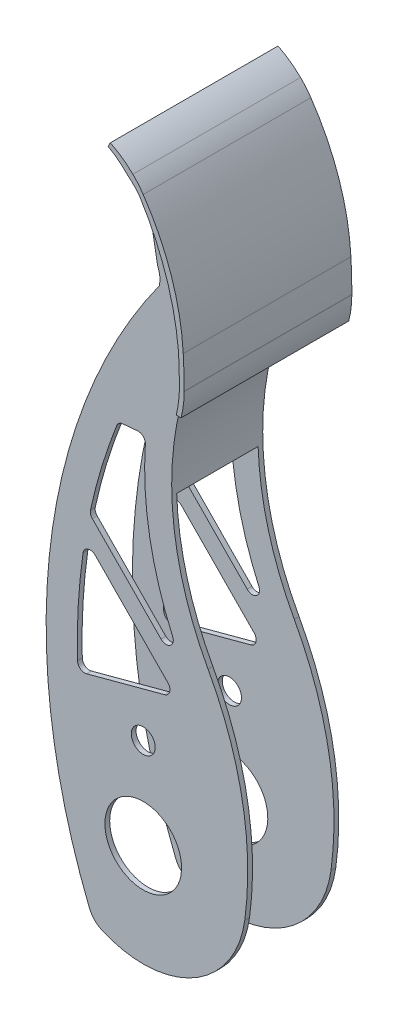
from build123d import *

# Parameters (mm, degrees)
SKETCH1_R           = 16
SKETCH1_R_2         = 5
BOSS_EXTRUDE3_DEPTH = 70
CUT_EXTRUDE2_DEPTH  = 16
CUT_EXTRUDE3_DEPTH  = 16
SKETCH7_W           = 34
SKETCH7_H           = 251.612307305
CUT_EXTRUDE4_DEPTH  = 87.5
CUT_EXTRUDE5_DEPTH  = 34
BOSS_EXTRUDE4_START = -38
BOSS_EXTRUDE4_DEPTH = 38
CUT_EXTRUDE6_DEPTH  = 135


with BuildPart() as part:
    # Sketch1 → Boss-Extrude3 (new body)
    with BuildSketch(Plane.XY):
        with BuildLine():
            Line((-18.492879119, 133.036316601), (-18.498498023, 133.025878551))
            ThreePointArc((-18.498498023, 133.025878551), (-22.931133945, 136.748933151), (-27.911859958, 139.698808598))
            Line((-27.911859958, 139.698808598), (-28.859852333, 137.937754807))
            ThreePointArc((-28.859852333, 137.937754807), (-24.623995913, 135.183968868), (-20.885371833, 131.785659496))
            ThreePointArc((-20.885371833, 131.785659496), (-18.192980361, 129.380347747), (-15.794912153, 126.681502565))
            Line((-15.794912153, 126.681502565), (-27.917185271, 110.194914382))
            Line((-27.917185271, 110.194914382), (-24.189891295, 89.250297825))
            ThreePointArc((-24.189891295, 89.250297825), (-23.276240724, 85.794240187), (-23.472804176, 82.224862851))
            ThreePointArc((-23.472804176, 82.224862851), (-68.872718383, -33.767386176), (-52.667247609, -157.269356853))
            ThreePointArc((-52.667247609, -157.269356853), (-50.575514204, -160.492975125), (-47.422535875, -162.689743445))
            ThreePointArc((-47.422535875, -162.689743445), (-9.297986917, -160.884668476), (12.205361962, -129.351423863))
            ThreePointArc((12.205361962, -129.351423863), (11.215393371, -86.524352781), (-3.124290711, -46.157144361))
            ThreePointArc((-3.124290711, -46.157144361), (-18.241573573, 16.806753647), (0.520816468, 78.782211802))
            ThreePointArc((0.520816468, 78.782211802), (0.815698001, 71.975939249), (0.917818465, 65.164047251))
            Line((0.917818465, 65.164047251), (0.943780266, 65.164047251))
            ThreePointArc((0.943780266, 65.164047251), (0.943812795, 65.09180253), (0.943823638, 65.019557802))
            ThreePointArc((0.943823638, 65.019557802), (0.529498651, 60.000787978), (-0.371750777, 55.04624812))
            Line((-0.371750777, 55.04624812), (1.628249223, 55.04624812))
            ThreePointArc((1.628249223, 55.04624812), (2.583543249, 60.061971917), (2.90683401, 65.157612698))
            ThreePointArc((2.90683401, 65.157612698), (2.906823344, 65.229857425), (2.906791346, 65.302102146))
            ThreePointArc((2.906791346, 65.302102146), (2.809025603, 72.019742255), (2.526858646, 78.732165705))
            ThreePointArc((2.526858646, 78.732165705), (-2.46660039, 104.447349639), (-14.187653785, 127.874304738))
            ThreePointArc((-14.187653785, 127.874304738), (-16.217340169, 130.557833748), (-18.492879119, 133.036316601))
        make_face()
        with Locations((-30.170544826, -123.552650361)):
            Circle(SKETCH1_R, mode=Mode.SUBTRACT)
        with Locations((-30.170544826, -85.552650361)):
            Circle(SKETCH1_R_2, mode=Mode.SUBTRACT)
    extrude(amount=BOSS_EXTRUDE3_DEPTH)

    # Sketch4 → Cut-Extrude2 (cut)
    with BuildSketch(Plane(origin=(0, 0, 0), x_dir=(-1, 0, 0), z_dir=(0, 0, -1))):
        with BuildLine():
            Line((27.917185271, 110.194914382), (15.794912153, 126.681502565))
            ThreePointArc((15.794912153, 126.681502565), (4.373722035, 103.843429765), (-0.520816468, 78.782211802))
            ThreePointArc((-0.520816468, 78.782211802), (18.241573573, 16.806753647), (3.124290711, -46.157144361))
            ThreePointArc((3.124290711, -46.157144361), (-11.215393371, -86.524352781), (-12.205361962, -129.351423863))
            ThreePointArc((-12.205361962, -129.351423863), (9.297986917, -160.884668476), (47.422535875, -162.689743445))
            ThreePointArc((47.422535875, -162.689743445), (50.575514204, -160.492975125), (52.667247609, -157.269356853))
            ThreePointArc((52.667247609, -157.269356853), (68.872718383, -33.767386176), (23.472804176, 82.224862851))
            ThreePointArc((23.472804176, 82.224862851), (23.276240724, 85.794240187), (24.189891295, 89.250297825))
            Line((24.189891295, 89.250297825), (27.917185271, 110.194914382))
        make_face()
    extrude(amount=-CUT_EXTRUDE2_DEPTH, mode=Mode.SUBTRACT)

    # Sketch5 → Cut-Extrude3 (cut)
    with BuildSketch(Plane.XY.offset(70)):
        with BuildLine():
            Line((-15.794912153, 126.681502565), (-106.344691982, 77.715450511))
            Line((-106.344691982, 77.715450511), (-99.056785555, -184.356883009))
            Line((-99.056785555, -184.356883009), (38.776437557, -199.728468659))
            Line((38.776437557, -199.728468659), (9.520070812, 37.732141377))
            Line((9.520070812, 37.732141377), (-2.731904314, 53.720528852))
            Line((-2.731904314, 53.720528852), (0.520816468, 78.782211802))
            ThreePointArc((0.520816468, 78.782211802), (-4.80960476, 103.694956914), (-15.794912153, 126.681502565))
        make_face()
    extrude(amount=-CUT_EXTRUDE3_DEPTH, mode=Mode.SUBTRACT)

    # Sketch7 → Cut-Extrude4 (cut, symmetric)
    with BuildSketch(Plane(origin=(0, 0, 0), x_dir=(0, 0, -1), z_dir=(1, 0, 0))):
        with Locations((-35, -70.759905532)):
            Rectangle(SKETCH7_W, SKETCH7_H)
    extrude(amount=CUT_EXTRUDE4_DEPTH, both=True, mode=Mode.SUBTRACT)

    # Sketch8 → Cut-Extrude5 (cut)
    with BuildSketch(Plane(origin=(0, 0, 52), x_dir=(-1, 0, 0), z_dir=(0, 0, -1))):
        with BuildLine():
            Line((15.794912153, 126.681502565), (103.727403684, 77.715450511))
            Line((103.727403684, 77.715450511), (65.201238751, -183.077529844))
            Line((65.201238751, -183.077529844), (-41.355481636, -162.759511126))
            Line((-41.355481636, -162.759511126), (-12.07256107, 35.463700067))
            Line((-12.07256107, 35.463700067), (7.253704803, 49.814895562))
            Line((7.253704803, 49.814895562), (-0.520816468, 78.782211802))
            ThreePointArc((-0.520816468, 78.782211802), (4.735822291, 103.720089118), (15.794912153, 126.681502565))
        make_face()
    extrude(amount=CUT_EXTRUDE5_DEPTH, mode=Mode.SUBTRACT)

    # Sketch9 → Boss-Extrude4 (add)
    with BuildSketch(Plane.XY.offset(54).offset(BOSS_EXTRUDE4_START)):
        with BuildLine():
            Line((-8.381762523, 61.719660218), (-9.752633242, 63.175927181))
            ThreePointArc((-9.752633242, 63.175927181), (-17.943118256, 36.524072516), (-20.049083933, 8.721728902))
            Line((-20.049083933, 8.721728902), (-18.21549071, 8.787163684))
            ThreePointArc((-18.21549071, 8.787163684), (-16.213088176, 35.794856709), (-8.381762523, 61.719660218))
        make_face()
    extrude(amount=BOSS_EXTRUDE4_DEPTH)

    # Sketch11 → Cut-Extrude6 (cut)
    with BuildSketch(Plane.XY.offset(54)):
        with BuildLine():
            Line((-50.185023147, -28.598308606), (-19.867347918, -59.472801703))
            ThreePointArc((-19.867347918, -59.472801703), (-19.113609075, -62.364150109), (-21.230995297, -64.472394267))
            Line((-21.230995297, -64.472394267), (-53.847995089, -73.217282749))
            ThreePointArc((-53.847995089, -73.217282749), (-56.418775041, -72.724188951), (-57.623794539, -70.400403449))
            ThreePointArc((-57.623794539, -70.400403449), (-57.31161949, -50.287283004), (-55.294991455, -30.273081081))
            ThreePointArc((-55.294991455, -30.273081081), (-53.259893991, -27.84944683), (-50.185023147, -28.598308606))
        make_face()
        with BuildLine():
            Line((-22.762737067, -45.106159898), (-51.405782898, -15.937052632))
            ThreePointArc((-51.405782898, -15.937052632), (-52.148347837, -14.664421133), (-52.195447125, -13.191744903))
            ThreePointArc((-52.195447125, -13.191744903), (-47.4284487, 5.029431131), (-41.229607384, 22.814534346))
            ThreePointArc((-41.229607384, 22.814534346), (-40.234764305, 24.117966642), (-38.703222855, 24.703653665))
            Line((-38.703222855, 24.703653665), (-32.552921731, 25.249075291))
            ThreePointArc((-32.552921731, 25.249075291), (-30.190849915, 24.406103869), (-29.294390199, 22.063809255))
            ThreePointArc((-29.294390199, 22.063809255), (-27.47951255, -10.554827918), (-17.882279592, -41.782418145))
            ThreePointArc((-17.882279592, -41.782418145), (-18.933525001, -45.483819939), (-22.762737067, -45.106159898))
        make_face()
    extrude(amount=-CUT_EXTRUDE6_DEPTH, mode=Mode.SUBTRACT)


solid = part.part
